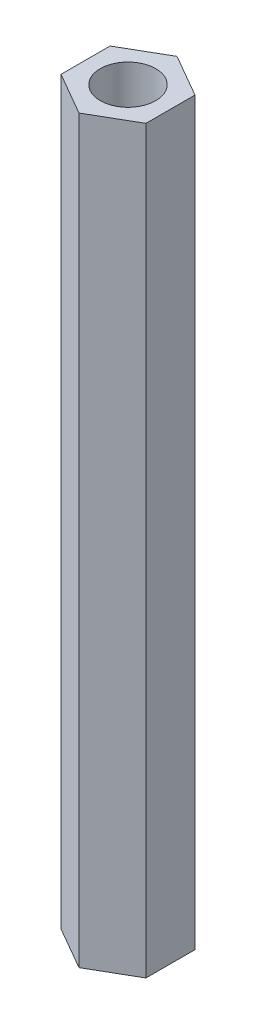
from build123d import *

# Parameters (mm, degrees)
SKETCH2_R           = 1.5
BOSS_EXTRUDE1_DEPTH = 40


with BuildPart() as part:
    # Sketch2 → Boss-Extrude1 (new body)
    with BuildSketch(Plane(origin=(0, 0, 0), x_dir=(1, 0, 0), z_dir=(0, 1, 0))):
        Polygon((0, 2.65), (-2.29496732, 1.325), (-2.29496732, -1.325), (0, -2.65), (2.29496732, -1.325), (2.29496732, 1.325), align=None)
        with Locations(Location((0, 0, 0), (0, 0, 270))):
            Circle(SKETCH2_R, mode=Mode.SUBTRACT)
    extrude(amount=BOSS_EXTRUDE1_DEPTH)


solid = part.part
